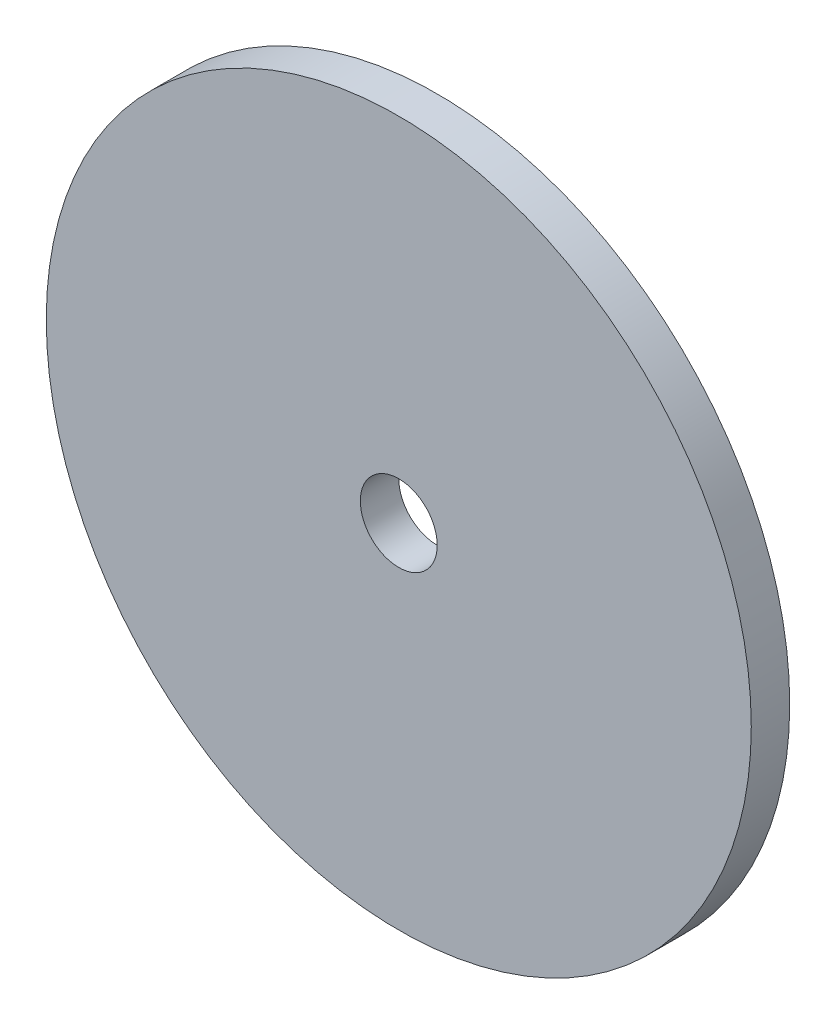
from build123d import *

# Parameters (mm, degrees)
SKETCH1_R           = 55
SKETCH1_R_2         = 6
BOSS_EXTRUDE1_DEPTH = 6


with BuildPart() as part:
    # Sketch1 → Boss-Extrude1 (new body)
    with BuildSketch(Plane.XY):
        Circle(SKETCH1_R)
        Circle(SKETCH1_R_2, mode=Mode.SUBTRACT)
    extrude(amount=BOSS_EXTRUDE1_DEPTH)


solid = part.part
